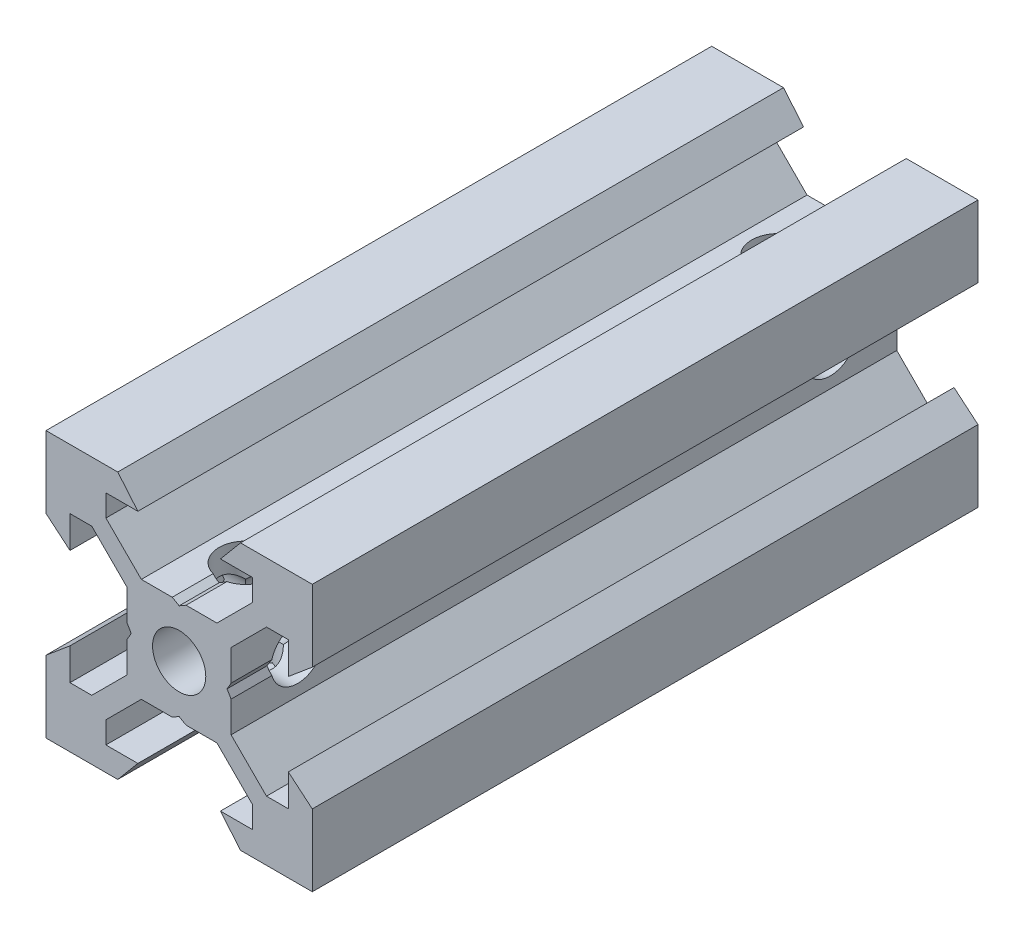
from build123d import *

# Parameters (mm, degrees)
SKETCH1_R               = 2
BOSS_EXTRUDE1_DEPTH     = 50
CUT_EXTRUDE1_DEPTH      = 53.850827808
CUT_EXTRUDE1_DEPTH_BACK = 53.850827808
SKETCH2_R               = 2
CUT_EXTRUDE2_DEPTH      = 53.850827808
CUT_EXTRUDE2_DEPTH_BACK = 53.850827808
SKETCH3_R               = 2


with BuildPart() as part:
    # Sketch1 → Boss-Extrude1 (new body)
    with BuildSketch(Plane.XY):
        Polygon((10, 10), (10, 4.610379336), (8.2, 3.1), (8.2, 5.5), (6.560660172, 5.5), (3.9, 2.839339828), (3.9, 0.519615242), (3.6, 0), (3.9, -0.519615242), (3.9, -2.839339828), (6.560660172, -5.5), (8.2, -5.5), (8.2, -3.1), (10, -4.610379336), (10, -10), (4.610379336, -10), (3.1, -8.2), (5.5, -8.2), (5.5, -6.560660172), (2.839339828, -3.9), (0.519615242, -3.9), (0, -3.6), (-0.519615242, -3.9), (-2.839339828, -3.9), (-5.5, -6.560660172), (-5.5, -8.2), (-3.1, -8.2), (-4.610379336, -10), (-10, -10), (-10, -4.610379336), (-8.2, -3.1), (-8.2, -5.5), (-6.560660172, -5.5), (-3.9, -2.839339828), (-3.9, -0.519615242), (-3.6, 0), (-3.9, 0.519615242), (-3.9, 2.839339828), (-6.560660172, 5.5), (-8.2, 5.5), (-8.2, 3.1), (-10, 4.610379336), (-10, 10), (-4.610379336, 10), (-3.1, 8.2), (-5.5, 8.2), (-5.5, 6.560660172), (-2.839339828, 3.9), (-0.519615242, 3.9), (0, 3.6), (0.519615242, 3.9), (2.839339828, 3.9), (5.5, 6.560660172), (5.5, 8.2), (3.1, 8.2), (4.610379336, 10), align=None)
        Circle(SKETCH1_R, mode=Mode.SUBTRACT)
    extrude(amount=BOSS_EXTRUDE1_DEPTH)

    # Sketch2 → Cut-Extrude1 (cut, two sides: drawn at the far end of the back side and taken through both)
    with BuildSketch(Plane(origin=(0, -3.9, 0), x_dir=(-1, 0, 0), z_dir=(0, -1, 0)).offset(-CUT_EXTRUDE1_DEPTH_BACK)):
        with Locations(Location((0, -5, 0), (0, 0, 90))):
            Circle(SKETCH2_R)
        with Locations(Location((0, -45, 0), (0, 0, 90))):
            Circle(SKETCH2_R)
    extrude(amount=CUT_EXTRUDE1_DEPTH + CUT_EXTRUDE1_DEPTH_BACK, mode=Mode.SUBTRACT)

    # Sketch3 → Cut-Extrude2 (cut, two sides: drawn at the far end of the back side and taken through both)
    with BuildSketch(Plane(origin=(3.9, 0, 0), x_dir=(0, 0, -1), z_dir=(1, 0, 0)).offset(-CUT_EXTRUDE2_DEPTH_BACK)):
        with Locations(Location((-45, 0, 0), (0, 0, 135))):
            Circle(SKETCH3_R)
        with Locations(Location((-5, 0, 0), (0, 0, 135))):
            Circle(SKETCH3_R)
    extrude(amount=CUT_EXTRUDE2_DEPTH + CUT_EXTRUDE2_DEPTH_BACK, mode=Mode.SUBTRACT)


solid = part.part
